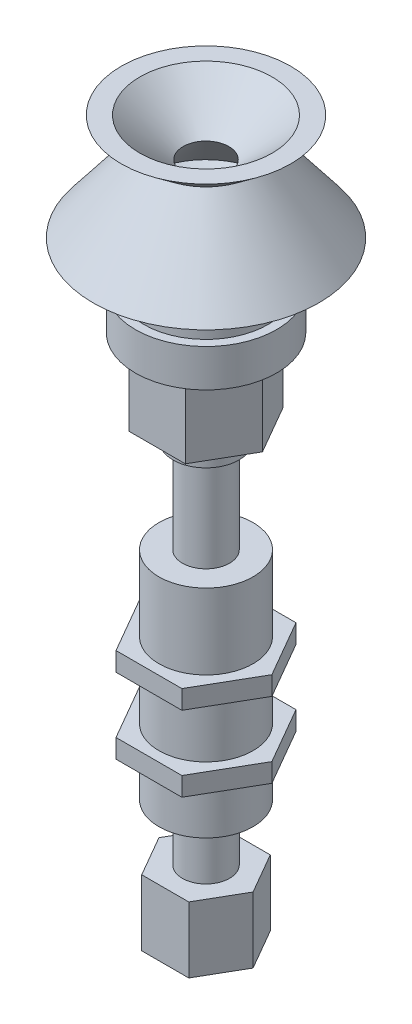
from build123d import *

# Parameters (mm, degrees)
EXTRUDE_1_DEPTH = 7
SKETCH_2_R      = 2.5
EXTRUDE_2_DEPTH = 6
SKETCH_3_R      = 5
EXTRUDE_3_DEPTH = 23
EXTRUDE_4_DEPTH = 2
EXTRUDE_5_DEPTH = 2
SKETCH_6_R      = 2.5
EXTRUDE_6_DEPTH = 10
SKETCH_7_R      = 3.5
EXTRUDE_7_DEPTH = 2
EXTRUDE_8_DEPTH = 8
SKETCH_9_R      = 7.5
EXTRUDE_9_DEPTH = 4


with BuildPart() as part:
    # 草图1 → 凸台-拉伸1 (new body)
    with BuildSketch(Plane(origin=(0, 0, 0), x_dir=(1, 0, 0), z_dir=(0, 1, 0))):
        Polygon((-2.5, -4.330127019), (2.5, -4.330127019), (5, 0), (2.5, 4.330127019), (-2.5, 4.330127019), (-5, 0), align=None)
    extrude(amount=EXTRUDE_1_DEPTH)

    # 草图2 → 凸台-拉伸2 (add)
    with BuildSketch(Plane(origin=(0, 7, 0), x_dir=(1, 0, 0), z_dir=(0, 1, 0))):
        with Locations(Location((0, 0, 0), (0, 0, 270))):
            Circle(SKETCH_2_R)
    extrude(amount=EXTRUDE_2_DEPTH)

    # 草图3 → 凸台-拉伸3 (add)
    with BuildSketch(Plane(origin=(0, 13, 0), x_dir=(1, 0, 0), z_dir=(0, 1, 0))):
        with Locations(Location((0, 0, 0), (0, 0, 270))):
            Circle(SKETCH_3_R)
    extrude(amount=EXTRUDE_3_DEPTH)

    # 草图4 → 凸台-拉伸4 (add)
    with BuildSketch(Plane(origin=(0, 18, 0), x_dir=(-1, 0, 0), z_dir=(0, -1, 0))):
        Polygon((3.5, -6.062177826), (7, 0), (3.5, 6.062177826), (-3.5, 6.062177826), (-7, 0), (-3.5, -6.062177826), align=None)
    extrude(amount=-EXTRUDE_4_DEPTH)

    # 草图5 → 凸台-拉伸5 (add)
    with BuildSketch(Plane(origin=(0, 28, 0), x_dir=(1, 0, 0), z_dir=(0, 1, 0))):
        Polygon((-3.5, -6.062177826), (3.5, -6.062177826), (7, 0), (3.5, 6.062177826), (-3.5, 6.062177826), (-7, 0), align=None)
    extrude(amount=-EXTRUDE_5_DEPTH)

    # 草图6 → 凸台-拉伸6 (add)
    with BuildSketch(Plane(origin=(0, 36, 0), x_dir=(1, 0, 0), z_dir=(0, 1, 0))):
        with Locations(Location((0, 0, 0), (0, 0, 270))):
            Circle(SKETCH_6_R)
    extrude(amount=EXTRUDE_6_DEPTH)

    # 草图7 → 凸台-拉伸7 (add)
    with BuildSketch(Plane(origin=(0, 46, 0), x_dir=(1, 0, 0), z_dir=(0, 1, 0))):
        with Locations(Location((0, 0, 0), (0, 0, 270))):
            Circle(SKETCH_7_R)
    extrude(amount=EXTRUDE_7_DEPTH)

    # 草图8 → 凸台-拉伸8 (add)
    with BuildSketch(Plane(origin=(0, 48, 0), x_dir=(1, 0, 0), z_dir=(0, 1, 0))):
        Polygon((-3, 5.196152423), (-6, 0), (-3, -5.196152423), (3, -5.196152423), (6, 0), (3, 5.196152423), align=None)
    extrude(amount=EXTRUDE_8_DEPTH)

    # 草图9 → 凸台-拉伸9 (add)
    with BuildSketch(Plane(origin=(0, 56, 0), x_dir=(1, 0, 0), z_dir=(0, 1, 0))):
        with Locations(Location((0, 0, 0), (0, 0, 270))):
            Circle(SKETCH_9_R)
    extrude(amount=EXTRUDE_9_DEPTH)

    # 草图10 → 旋转2 (revolve)
    with BuildSketch(Plane(origin=(0, 0, 0), x_dir=(0, 0, -1), z_dir=(1, 0, 0)), mode=Mode.PRIVATE) as revolve_2_sk:
        Polygon((3.288999148, 64.305632713), (3.288999148, 60), (6.577998295, 60), (6.577998295, 61.5442992), (12, 64.711607127), (5.398859255, 73.199272663), (9, 76), (7.026755152, 76), (2.426170638, 71.892250876), (6.577998295, 67.242299418), align=None)
    revolve(revolve_2_sk.sketch.rotate(Axis((0, 76, 0), (0, -1, 0)), 180), axis=Axis((0, 76, 0), (0, -1, 0)))


solid = part.part
